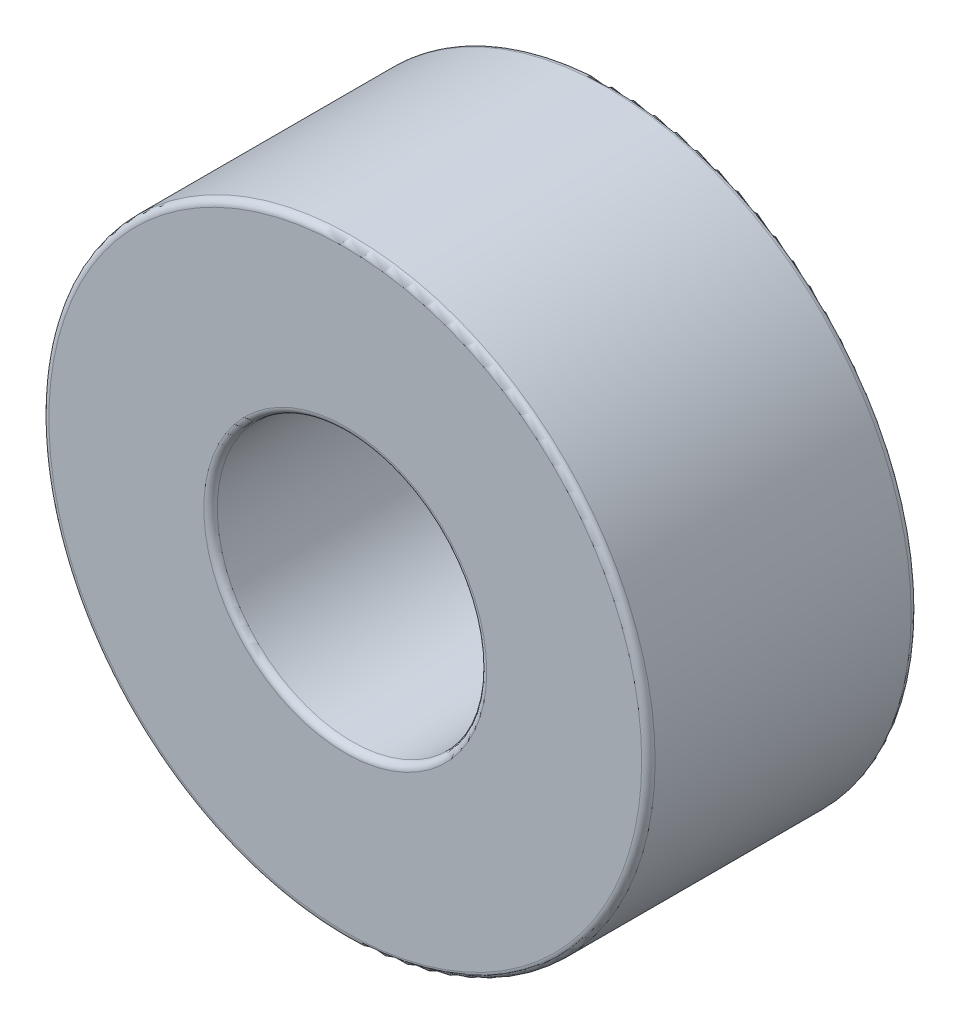
from build123d import *

# Parameters (mm, degrees)
SKETCH1_R           = 4.5
SKETCH1_R_2         = 2
BOSS_EXTRUDE1_DEPTH = 4
FILLET1_R           = 0.1


with BuildPart() as part:
    # Sketch1 → Boss-Extrude1 (new body)
    with BuildSketch(Plane.XY):
        Circle(SKETCH1_R)
        Circle(SKETCH1_R_2, mode=Mode.SUBTRACT)
    extrude(amount=BOSS_EXTRUDE1_DEPTH)

    # Fillet1
    fillet1_edges = [part.edges().sort_by_distance(p)[0] for p in [
        (-4.5, 0, 0),
        (-4.5, 0, 4),
        (-2, 0, 0),
        (-2, 0, 4),
    ]]
    fillet(fillet1_edges, radius=FILLET1_R)


solid = part.part
